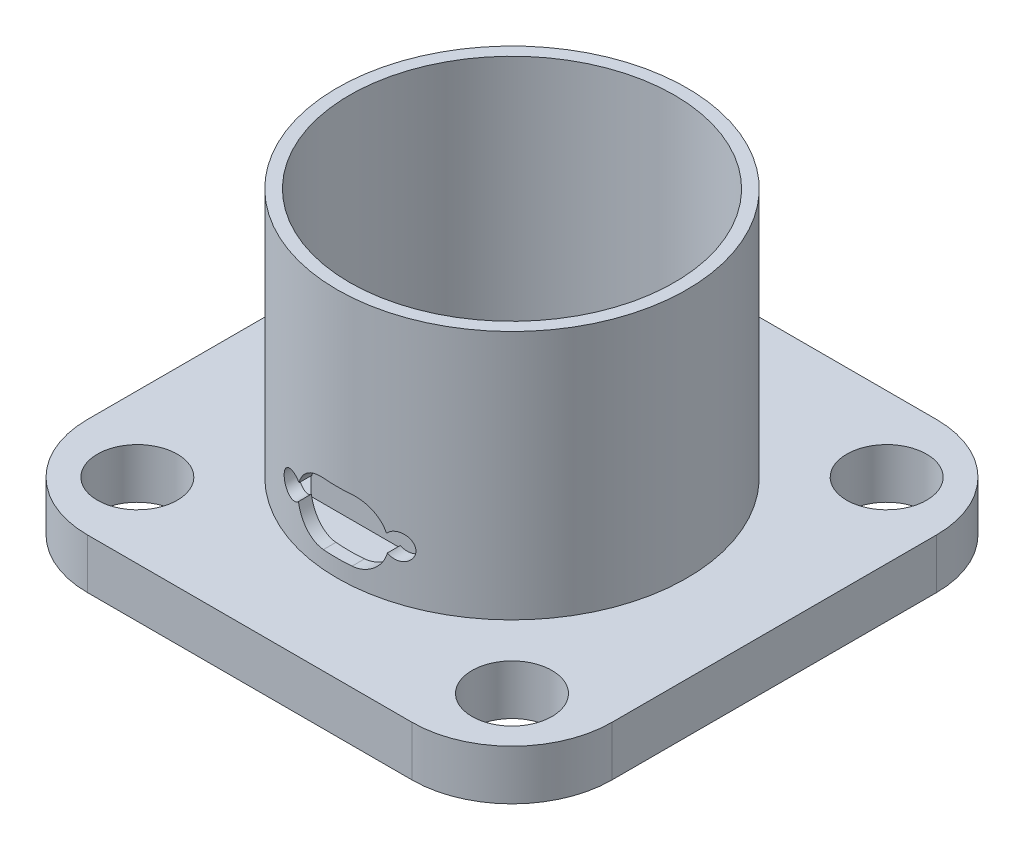
from build123d import *

# Parameters (mm, degrees)
SKETCH1_W               = 21
SKETCH1_H               = 21
BOSS_EXTRUDE1_DEPTH     = 2
BOSS_EXTRUDE2_START     = -2
BOSS_EXTRUDE2_DEPTH     = 2
SKETCH3_R               = 1.6
CUT_EXTRUDE1_DEPTH      = 16.378556499
SKETCH5_R               = 7
BOSS_EXTRUDE3_DEPTH     = 10
SKETCH6_R               = 6.5
CUT_EXTRUDE2_DEPTH      = 10
CUT_EXTRUDE3_REACH      = 25.675
CUT_EXTRUDE3_END_RADIUS = 6.5
BOSS_EXTRUDE4_DEPTH     = 4
SKETCH14_R              = 0.5
CUT_EXTRUDE4_DEPTH      = 10
FILLET1_R               = 4


with BuildPart() as part:
    # Sketch1 → Boss-Extrude1 (new body)
    with BuildSketch(Plane(origin=(0, 0, 0), x_dir=(1, 0, 0), z_dir=(0, 1, 0))):
        Rectangle(SKETCH1_W, SKETCH1_H)
    extrude(amount=BOSS_EXTRUDE1_DEPTH)

    # Sketch4 → Boss-Extrude2 (add)
    with BuildSketch(Plane(origin=(0, 2, 0), x_dir=(1, 0, 0), z_dir=(0, 1, 0)).offset(BOSS_EXTRUDE2_START)):
        with BuildLine():
            Line((-5.761508712, -1.270833333), (-6.632541509, -1.270833333))
            Line((-6.632541509, -1.270833333), (-6.632541509, 1.229166667))
            Line((-6.632541509, 1.229166667), (-5.770541509, 1.229166667))
            ThreePointArc((-5.770541509, 1.229166667), (0, 5.9), (5.770541509, 1.229166667))
            Line((5.770541509, 1.229166667), (6.632541509, 1.229166667))
            Line((6.632541509, 1.229166667), (6.632541509, -1.270833333))
            Line((6.632541509, -1.270833333), (5.761508712, -1.270833333))
            ThreePointArc((5.761508712, -1.270833333), (0, -5.9), (-5.761508712, -1.270833333))
        make_face()
    extrude(amount=-BOSS_EXTRUDE2_DEPTH)

    # Sketch3 → Cut-Extrude1 (cut, through all)
    with BuildSketch(Plane(origin=(0, 2, 0), x_dir=(1, 0, 0), z_dir=(0, 1, 0))):
        with Locations(Location((-7.5, 7.5, 0), (0, 0, 270))):
            Circle(SKETCH3_R)
        with Locations(Location((7.5, 7.5, 0), (0, 0, 270))):
            Circle(SKETCH3_R)
        with Locations(Location((7.5, -7.5, 0), (0, 0, 270))):
            Circle(SKETCH3_R)
        with Locations(Location((-7.5, -7.5, 0), (0, 0, 270))):
            Circle(SKETCH3_R)
    extrude(amount=-CUT_EXTRUDE1_DEPTH, mode=Mode.SUBTRACT)

    # Sketch5 → Boss-Extrude3 (add)
    with BuildSketch(Plane(origin=(0, 2, 0), x_dir=(1, 0, 0), z_dir=(0, 1, 0))):
        with Locations(Location((0, 0, 0), (0, 0, 270))):
            Circle(SKETCH5_R)
    extrude(amount=BOSS_EXTRUDE3_DEPTH)

    # Sketch6 → Cut-Extrude2 (cut)
    with BuildSketch(Plane(origin=(0, 12, 0), x_dir=(1, 0, 0), z_dir=(0, 1, 0))):
        with Locations(Location((0, 0, 0), (0, 0, 270))):
            Circle(SKETCH6_R)
    extrude(amount=-CUT_EXTRUDE2_DEPTH, mode=Mode.SUBTRACT)

    # Cut-Extrude3: up to this cylinder (the profile starts outside it)
    cut_extrude3_end = Plane(origin=(0, 3.932073, 0), z_dir=(0, 1, 0)) * Cylinder(CUT_EXTRUDE3_END_RADIUS, 65.35, mode=Mode.PRIVATE)
    # Sketch12 → Cut-Extrude3 (cut, up to the surface)
    with BuildSketch(Plane.XY.offset(7), mode=Mode.PRIVATE) as cut_extrude3_sk1:
        with BuildLine():
            Line((0.5734508, 2.691842334), (-0.5734508, 2.691842334))
            ThreePointArc((-0.5734508, 2.691842334), (-1.813681206, 3.93207274), (-0.5734508, 5.172303147))
            Line((-0.5734508, 5.172303147), (0.5734508, 5.172303147))
            ThreePointArc((0.5734508, 5.172303147), (1.813681206, 3.93207274), (0.5734508, 2.691842334))
        make_face()
    cut_extrude3_tool1 = extrude(cut_extrude3_sk1.sketch, amount=-CUT_EXTRUDE3_REACH, mode=Mode.PRIVATE) - cut_extrude3_end
    add(cut_extrude3_tool1.solids().sort_by_distance((0, 3.932073, 7))[0], mode=Mode.SUBTRACT)

    # Sketch13 → Boss-Extrude4 (add)
    with BuildSketch(Plane(origin=(0, 2, 0), x_dir=(1, 0, 0), z_dir=(0, 1, 0))):
        Polygon((-2.85, -4.69012427), (2.85, -4.69012427), (3.35, -4.69012427), (3.35, -1.69012427), (2.85, -1.69012427), (2.85, -4.19012427), (-2.85, -4.19012427), (-2.85, -1.69012427), (-3.35, -1.69012427), (-3.35, -4.69012427), align=None)
    extrude(amount=BOSS_EXTRUDE4_DEPTH)

    # Sketch14 → Cut-Extrude4 (cut)
    with BuildSketch(Plane(origin=(0, 0, 4.19012427), x_dir=(-1, 0, 0), z_dir=(0, 0, -1))):
        with Locations((-2.1375, 4)):
            Circle(SKETCH14_R)
        with Locations((-0.7125, 4)):
            Circle(SKETCH14_R)
        with Locations((0.7125, 4)):
            Circle(SKETCH14_R)
        with Locations((2.1375, 4)):
            Circle(SKETCH14_R)
    extrude(amount=-CUT_EXTRUDE4_DEPTH, mode=Mode.SUBTRACT)

    # Fillet1
    fillet1_edges = [part.edges().sort_by_distance(p)[0] for p in [
        (-10.5, 1, -10.5),
        (10.5, 1, -10.5),
        (10.5, 1, 10.5),
        (-10.5, 1, 10.5),
    ]]
    fillet(fillet1_edges, radius=FILLET1_R)


solid = part.part
